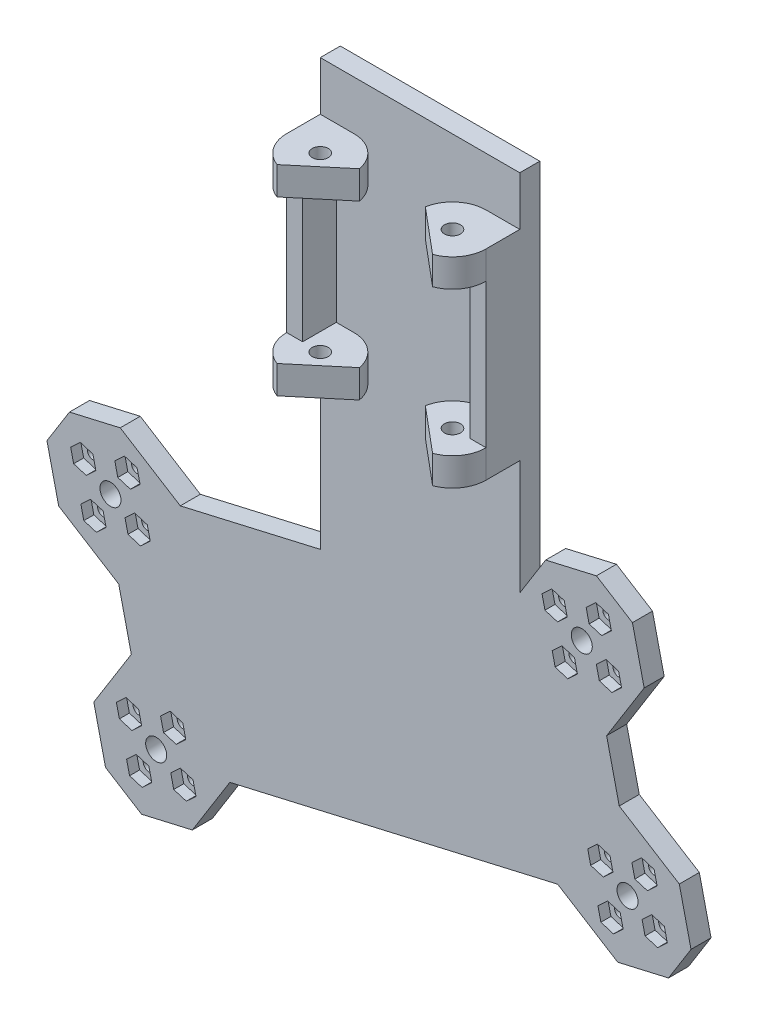
from build123d import *

# Parameters (mm, degrees)
BOSS_EXTRUDE2_DEPTH      = 7
CUT_EXTRUDE2_DEPTH       = 30.130224853
CUT_EXTRUDE2_DEPTH_BACK  = 30.130224853
SKETCH3_R                = 2
BOSS_EXTRUDE3_DEPTH      = 36
SKETCH5_R                = 2
BOSS_EXTRUDE4_DEPTH      = 7
SKETCH13_W               = 49.8
SKETCH13_H               = 5
BOSS_EXTRUDE6_DEPTH      = 12.25
SKETCH15_W               = 49.8
SKETCH15_H               = 5
BOSS_EXTRUDE7_DEPTH      = 30
BOSS_EXTRUDE8_DEPTH      = 5
CUT_EXTRUDE3_DEPTH       = 158.990977444
CUT_EXTRUDE3_DEPTH_BACK  = 158.990977444
SKETCH16_R               = 2.625
SKETCH16_R_2             = 1.5
CUT_EXTRUDE8_DEPTH       = 2.5
CUT_EXTRUDE11_DEPTH      = 159.584168371
CUT_EXTRUDE11_DEPTH_BACK = 159.584168371
CHAMFER2_SIZE            = 7.5


with BuildPart() as part:
    # Sketch1 → Boss-Extrude2 (new body)
    with BuildSketch(Plane(origin=(0, 0, 0), x_dir=(1, 0, 0), z_dir=(0, 1, 0))):
        with BuildLine():
            Line((-24.9, 0), (-24.9, 13.4))
            Line((-24.9, 13.4), (24.9, 13.4))
            Line((24.9, 13.4), (24.9, 0))
            ThreePointArc((24.9, 0), (23.392904185, -4.800819919), (19.412411454, -7.878950407))
            Line((19.412411454, -7.878950407), (8.235013612, 1.5))
            ThreePointArc((8.235013612, 1.5), (11.116692467, 6.448255578), (16.5, 8.4))
            Line((16.5, 8.4), (-16.5, 8.4))
            ThreePointArc((-16.5, 8.4), (-11.116692467, 6.448255578), (-8.235013612, 1.5))
            Line((-8.235013612, 1.5), (-19.412411454, -7.878950407))
            ThreePointArc((-19.412411454, -7.878950407), (-23.392904185, -4.800819919), (-24.9, 0))
        make_face()
    extrude(amount=BOSS_EXTRUDE2_DEPTH)

    # Sketch3 → Cut-Extrude2 (cut, two sides: drawn at the far end of the back side and taken through both)
    with BuildSketch(Plane(origin=(0, 7, 0), x_dir=(1, 0, 0), z_dir=(0, 1, 0)).offset(-CUT_EXTRUDE2_DEPTH_BACK)):
        with Locations(Location((-16.5, 0, 0), (0, 0, 270))):
            Circle(SKETCH3_R)
        with Locations(Location((16.5, 0, 0), (0, 0, 270))):
            Circle(SKETCH3_R)
    extrude(amount=CUT_EXTRUDE2_DEPTH + CUT_EXTRUDE2_DEPTH_BACK, mode=Mode.SUBTRACT)

    # Sketch4 → Boss-Extrude3 (add)
    with BuildSketch(Plane(origin=(0, 7, 0), x_dir=(1, 0, 0), z_dir=(0, 1, 0))):
        Polygon((-24.9, 13.4), (-24.9, 0), (-20.9, 0), (-20.9, 8.4), (-16.5, 8.4), (16.5, 8.4), (20.9, 8.4), (20.9, 0), (24.9, 0), (24.9, 13.4), align=None)
    extrude(amount=BOSS_EXTRUDE3_DEPTH)

    # Sketch5 → Boss-Extrude4 (add)
    with BuildSketch(Plane(origin=(0, 43, 0), x_dir=(1, 0, 0), z_dir=(0, 1, 0))):
        with BuildLine():
            Line((-24.9, 13.4), (-24.9, 0))
            ThreePointArc((-24.9, 0), (-23.392904185, -4.800819919), (-19.412411454, -7.878950407))
            Line((-19.412411454, -7.878950407), (-8.235013612, 1.5))
            ThreePointArc((-8.235013612, 1.5), (-11.116692467, 6.448255578), (-16.5, 8.4))
            Line((-16.5, 8.4), (16.5, 8.4))
            ThreePointArc((16.5, 8.4), (11.116692467, 6.448255578), (8.235013612, 1.5))
            Line((8.235013612, 1.5), (19.412411454, -7.878950407))
            ThreePointArc((19.412411454, -7.878950407), (23.392904185, -4.800819919), (24.9, 0))
            Line((24.9, 0), (24.9, 13.4))
            Line((24.9, 13.4), (-24.9, 13.4))
        make_face()
        with Locations(Location((16.5, 0, 0), (0, 0, 270))):
            Circle(SKETCH5_R, mode=Mode.SUBTRACT)
        with Locations(Location((-16.5, 0, 0), (0, 0, 270))):
            Circle(SKETCH5_R, mode=Mode.SUBTRACT)
    extrude(amount=BOSS_EXTRUDE4_DEPTH)

    # Sketch13 → Boss-Extrude6 (add)
    with BuildSketch(Plane(origin=(0, 50, 0), x_dir=(1, 0, 0), z_dir=(0, 1, 0))):
        with Locations((0, 10.9)):
            Rectangle(SKETCH13_W, SKETCH13_H)
    extrude(amount=BOSS_EXTRUDE6_DEPTH)

    # Sketch15 → Boss-Extrude7 (add)
    with BuildSketch(Plane.XZ):
        with Locations((0, -10.9)):
            Rectangle(SKETCH15_W, SKETCH15_H)
    extrude(amount=BOSS_EXTRUDE7_DEPTH)

    # Sketch12 → Boss-Extrude8 (add)
    with BuildSketch(Plane(origin=(0, 0, -13.4), x_dir=(-1, 0, 0), z_dir=(0, 0, -1))):
        Polygon((2.249510543, -26.004917311), (-51.34084302, -13.632609322), (-69.336927367, -91.582214505), (-15.746573804, -103.954522494), (76.818582351, -125.324872657), (94.814666698, -47.375267474), (24.9, -31.23419484), (24.9, -30), (19.554114826, -30), align=None)
    extrude(amount=-BOSS_EXTRUDE8_DEPTH)

    # Sketch16 → Cut-Extrude3 (cut, two sides: drawn at the far end of the back side and taken through both)
    with BuildSketch(Plane.XY.offset(-8.4).offset(-CUT_EXTRUDE3_DEPTH_BACK)):
        with Locations((40.380589992, -31.17268069)):
            Circle(SKETCH16_R)
        with Locations((47.164974761, -35.412034803)):
            Circle(SKETCH16_R_2)
        with Locations((36.141235878, -37.957065459)):
            Circle(SKETCH16_R_2)
        with Locations((33.596205223, -26.933326576)):
            Circle(SKETCH16_R_2)
        with Locations((44.619944106, -24.38829592)):
            Circle(SKETCH16_R_2)
        with Locations(Location((47.557501886, -87.406346247, 0), (0, 0, 180))):
            Circle(SKETCH16_R_2)
        with Locations(Location((45.012471231, -76.382607364, 0), (0, 0, 180))):
            Circle(SKETCH16_R_2)
        with Locations(Location((58.581240769, -84.861315591, 0), (0, 0, 180))):
            Circle(SKETCH16_R_2)
        with Locations(Location((56.036210114, -73.837576708, 0), (0, 0, 180))):
            Circle(SKETCH16_R_2)
        with Locations(Location((51.796856, -80.621961477, 0), (0, 0, 180))):
            Circle(SKETCH16_R)
        with Locations(Location((-73.035241217, -51.551135732, 0), (0, 0, 180))):
            Circle(SKETCH16_R_2)
        with Locations(Location((-84.0589801, -54.096166388, 0), (0, 0, 180))):
            Circle(SKETCH16_R_2)
        with Locations(Location((-81.513949445, -65.119905271, 0), (0, 0, 180))):
            Circle(SKETCH16_R_2)
        with Locations(Location((-77.274595331, -58.335520502, 0), (0, 0, 180))):
            Circle(SKETCH16_R)
        with Locations(Location((-70.490210562, -62.574874615, 0), (0, 0, 180))):
            Circle(SKETCH16_R_2)
        with Locations((-61.618975209, -101.00041652)):
            Circle(SKETCH16_R_2)
        with Locations((-72.642714092, -103.545447176)):
            Circle(SKETCH16_R_2)
        with Locations((-70.097683437, -114.569186059)):
            Circle(SKETCH16_R_2)
        with Locations((-65.858329323, -107.784801289)):
            Circle(SKETCH16_R)
        with Locations((-59.073944554, -112.024155403)):
            Circle(SKETCH16_R_2)
    extrude(amount=CUT_EXTRUDE3_DEPTH + CUT_EXTRUDE3_DEPTH_BACK, mode=Mode.SUBTRACT)

    # Sketch22 → Cut-Extrude8 (cut)
    with BuildSketch(Plane.XY.offset(-8.4)):
        Polygon((32.855914578, -23.726775506), (30.449105216, -25.971161546), (31.189395861, -29.177712615), (34.336495868, -30.139877645), (36.74330523, -27.895491605), (36.003014585, -24.688940536), align=None)
        Polygon((43.879653461, -21.181744851), (41.472844099, -23.42613089), (42.213134744, -26.63268196), (45.360234751, -27.59484699), (47.767044113, -25.35046095), (47.026753468, -22.143909881), align=None)
        Polygon((46.424684116, -32.205483734), (44.017874754, -34.449869774), (44.758165399, -37.656420843), (47.905265406, -38.618585873), (50.312074769, -36.374199833), (49.571784123, -33.167648764), align=None)
        Polygon((38.54804524, -35.712679419), (35.400945233, -34.750514389), (32.994135871, -36.994900429), (33.734426516, -40.201451498), (36.881526523, -41.163616528), (39.288335885, -38.919230489), align=None)
        Polygon((47.419280593, -74.138221324), (48.159571238, -77.344772393), (45.752761876, -79.589158433), (42.605661869, -78.626993403), (41.865371224, -75.420442334), (44.272180586, -73.176056294), align=None)
        Polygon((50.704601893, -88.368511276), (48.297792531, -90.612897316), (45.150692524, -89.650732286), (44.410401879, -86.444181217), (46.817211241, -84.199795177), (49.964311248, -85.161960207), align=None)
        Polygon((61.728340776, -85.823480621), (59.321531414, -88.067866661), (56.174431407, -87.105701631), (55.434140762, -83.899150561), (57.840950124, -81.654764522), (60.988050131, -82.616929552), align=None)
        Polygon((59.183310121, -74.799741738), (56.776500759, -77.044127778), (53.629400752, -76.081962748), (52.889110107, -72.875411678), (55.295919469, -70.631025639), (58.443019476, -71.593190669), align=None)
        Polygon((-73.244783444, -113.607021029), (-72.504492799, -116.813572098), (-69.357392792, -117.775737128), (-66.950583429, -115.531351088), (-67.690874075, -112.324800019), (-70.837974082, -111.362634989), align=None)
        Polygon((-62.221044561, -111.061990373), (-61.480753916, -114.268541443), (-58.333653908, -115.230706473), (-55.926844546, -112.986320433), (-56.667135192, -109.779769364), (-59.814235199, -108.817604334), align=None)
        Polygon((-75.789814099, -102.583282146), (-75.049523454, -105.789833215), (-71.902423447, -106.751998245), (-69.495614085, -104.507612205), (-70.23590473, -101.301061136), (-73.383004737, -100.338896106), align=None)
        Polygon((-62.359265854, -97.793865451), (-64.766075216, -100.03825149), (-64.025784571, -103.24480256), (-60.878684564, -104.20696759), (-58.471875202, -101.96258155), (-59.212165847, -98.756030481), align=None)
        Polygon((-72.897019924, -64.819260655), (-73.637310569, -61.612709586), (-71.230501207, -59.368323546), (-68.083401199, -60.330488576), (-67.343110554, -63.537039645), (-69.749919916, -65.781425685), align=None)
        Polygon((-76.182341224, -50.588970702), (-73.775531862, -48.344584663), (-70.628431855, -49.306749693), (-69.88814121, -52.513300762), (-72.294950572, -54.757686802), (-75.442050579, -53.795521772), align=None)
        Polygon((-84.661049452, -64.157740241), (-82.25424009, -61.913354201), (-79.107140083, -62.875519231), (-78.366849437, -66.082070301), (-80.773658799, -68.32645634), (-83.920758807, -67.36429131), align=None)
        Polygon((-87.206080107, -53.134001358), (-84.799270745, -50.889615318), (-81.652170738, -51.851780348), (-80.911880093, -55.058331418), (-83.318689455, -57.302717457), (-86.465789462, -56.340552427), align=None)
    extrude(amount=-CUT_EXTRUDE8_DEPTH, mode=Mode.SUBTRACT)

    # Sketch30 → Cut-Extrude11 (cut, two sides: drawn at the far end of the back side and taken through both)
    with BuildSketch(Plane(origin=(0, 0, -13.4), x_dir=(-1, 0, 0), z_dir=(0, 0, -1)).offset(-CUT_EXTRUDE11_DEPTH_BACK)):
        Polygon((47.470317994, -105.720490605), (-34.364886652, -86.827344937), (-49.356400642, -96.195082568), (56.838055625, -120.712004594), align=None)
        Polygon((-64.724059304, -71.601687779), (-49.732545315, -62.233950149), (-48.159259384, -55.419300093), (-46.585973452, -48.604650037), (-55.953711083, -33.613136048), align=None)
        Polygon((-24.9, -28.584144619), (-31.360316294, -18.245477385), (-24.9, -19.736958922), align=None)
        Polygon((59.842625983, -52.130137041), (74.834139972, -42.762399411), (24.9, -31.23419484), (24.9, -44.062996188), align=None)
        Polygon((81.431450413, -105.344345931), (72.063712783, -90.352831942), (73.636998714, -83.538181886), (75.210284646, -76.72353183), (90.201798635, -67.355794199), align=None)
    extrude(amount=CUT_EXTRUDE11_DEPTH + CUT_EXTRUDE11_DEPTH_BACK, mode=Mode.SUBTRACT)

    # Chamfer2
    chamfer2_edges = [part.edges().sort_by_distance(p)[0] for p in [
        (51.34084302, -13.632609322, -10.9),
        (-94.814666698, -47.375267474, -10.9),
        (-76.818582351, -125.324872657, -10.9),
        (69.336927367, -91.582214505, -10.9),
    ]]
    chamfer(chamfer2_edges, length=CHAMFER2_SIZE)


solid = part.part
